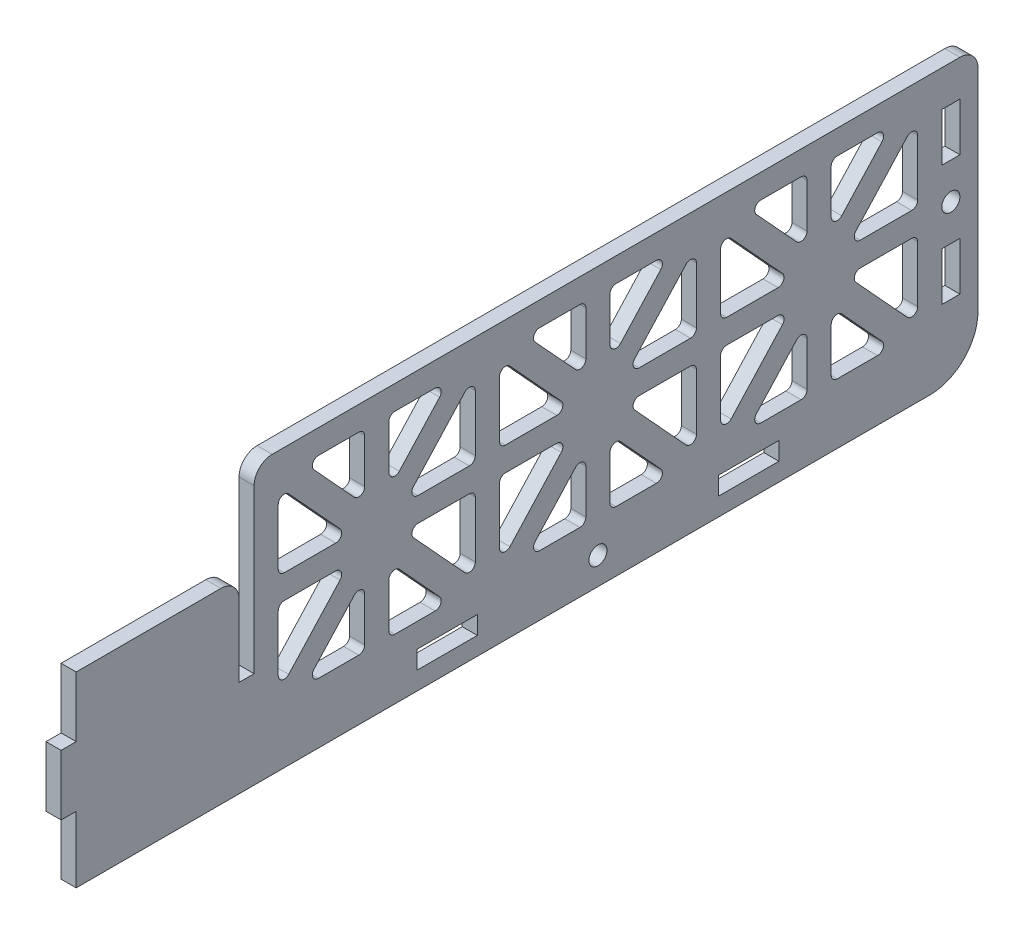
from build123d import *

# Parameters (mm, degrees)
SKETCH_1_R          = 1.5
SKETCH_1_W          = 3
SKETCH_1_H          = 8
SKETCH_1_W_2        = 10
SKETCH_1_H_2        = 3
EXTRUDE_1_DEPTH     = 2.5
FILLET_1_R          = 8
FILLET_2_R          = 3
CUT_EXTRUDE_1_DEPTH = 157.436888233
FILLET_3_R          = 1


with BuildPart() as part:
    # 草图1 → 凸台-拉伸1 (new body)
    with BuildSketch(Plane(origin=(0, 0, 0), x_dir=(0, 0, -1), z_dir=(1, 0, 0))):
        Polygon((0, 0), (149.5, 0), (149.5, 46), (29.5, 46), (29.5, 16), (27, 16), (27, 31), (0, 31), (0, 21), (-2.5, 21), (-2.5, 11), (0, 11), align=None)
        with Locations((86.5, 4.5)):
            Circle(SKETCH_1_R, mode=Mode.SUBTRACT)
        with Locations((145, 26)):
            Circle(SKETCH_1_R, mode=Mode.SUBTRACT)
        with Locations((145, 36)):
            Rectangle(SKETCH_1_W, SKETCH_1_H, mode=Mode.SUBTRACT)
        with Locations((145, 16)):
            Rectangle(SKETCH_1_W, SKETCH_1_H, mode=Mode.SUBTRACT)
        with Locations((111.5, 4.5)):
            Rectangle(SKETCH_1_W_2, SKETCH_1_H_2, mode=Mode.SUBTRACT)
        with Locations((61.5, 4.5)):
            Rectangle(SKETCH_1_W_2, SKETCH_1_H_2, mode=Mode.SUBTRACT)
    extrude(amount=EXTRUDE_1_DEPTH)

    # 圆角1
    fillet_1_edges = [part.edges().sort_by_distance(p)[0] for p in [
        (1.25, 0, -149.5),
    ]]
    fillet(fillet_1_edges, radius=FILLET_1_R)

    # 圆角2
    fillet_2_edges = [part.edges().sort_by_distance(p)[0] for p in [
        (1.25, 31, -27),
        (1.25, 46, -29.5),
        (1.25, 46, -149.5),
    ]]
    fillet(fillet_2_edges, radius=FILLET_2_R)

    # 草图2 → 切除-拉伸1 (cut, through all)
    with BuildSketch(Plane(origin=(2.5, 0, 0), x_dir=(0, 0, -1), z_dir=(1, 0, 0))):
        Polygon((21.09397139, 104.600915735), (21.09397139, 93.014462547), (31.100453689, 93.014462547), align=None)
        Polygon((25.191142636, 105.976587705), (33.21163679, 96.689699737), (33.21163679, 105.976587705), align=None)
        Polygon((37.21163679, 105.976587705), (45.232130944, 105.976587705), (37.21163679, 96.689699737), align=None)
        Polygon((49.32930219, 93.014462547), (39.322819891, 93.014462547), (49.32930219, 104.600915735), align=None)
        Polygon((49.32930219, 78.0271398), (49.32930219, 89.613592988), (39.322819891, 89.613592988), align=None)
        Polygon((37.21163679, 85.938355799), (37.21163679, 76.651467831), (45.232130944, 76.651467831), align=None)
        Polygon((33.21163679, 76.651467831), (25.191142636, 76.651467831), (33.21163679, 85.938355799), align=None)
        Polygon((21.09397139, 89.613592988), (31.100453689, 89.613592988), (21.09397139, 78.0271398), align=None)
        Polygon((33.5, 40.858396255), (33.5, 28), (45.286863234, 28), align=None)
        Polygon((37.879803433, 42), (47.833333333, 31.141603745), (47.833333333, 42), align=None)
        Polygon((51.833333333, 42), (61.786863234, 42), (51.833333333, 31.141603745), align=None)
        Polygon((66.166666667, 28), (54.379803433, 28), (66.166666667, 40.858396255), align=None)
        Polygon((66.166666667, 11.141603745), (66.166666667, 24), (54.379803433, 24), align=None)
        Polygon((51.833333333, 20.858396255), (51.833333333, 10), (61.786863234, 10), align=None)
        Polygon((47.833333333, 10), (37.879803433, 10), (47.833333333, 20.858396255), align=None)
        Polygon((33.5, 24), (45.286863234, 24), (33.5, 11.141603745), align=None)
        Polygon((70.166666667, 40.858396255), (70.166666667, 28), (81.953529901, 28), align=None)
        Polygon((74.546470099, 42), (84.5, 31.141603745), (84.5, 42), align=None)
        Polygon((88.5, 42), (98.453529901, 42), (88.5, 31.141603745), align=None)
        Polygon((102.833333333, 28), (91.046470099, 28), (102.833333333, 40.858396255), align=None)
        Polygon((102.833333333, 11.141603745), (102.833333333, 24), (91.046470099, 24), align=None)
        Polygon((88.5, 20.858396255), (88.5, 10), (98.453529901, 10), align=None)
        Polygon((84.5, 10), (74.546470099, 10), (84.5, 20.858396255), align=None)
        Polygon((70.166666667, 24), (81.953529901, 24), (70.166666667, 11.141603745), align=None)
        Polygon((106.833333333, 40.858396255), (106.833333333, 28), (118.620196567, 28), align=None)
        Polygon((111.213136766, 42), (121.166666667, 31.141603745), (121.166666667, 42), align=None)
        Polygon((125.166666667, 42), (135.120196567, 42), (125.166666667, 31.141603745), align=None)
        Polygon((139.5, 28), (127.713136766, 28), (139.5, 40.858396255), align=None)
        Polygon((139.5, 11.141603745), (139.5, 24), (127.713136766, 24), align=None)
        Polygon((125.166666667, 20.858396255), (125.166666667, 10), (135.120196567, 10), align=None)
        Polygon((121.166666667, 10), (111.213136766, 10), (121.166666667, 20.858396255), align=None)
        Polygon((106.833333333, 24), (118.620196567, 24), (106.833333333, 11.141603745), align=None)
    extrude(amount=-CUT_EXTRUDE_1_DEPTH, mode=Mode.SUBTRACT)

    # 圆角3
    fillet_3_edges = [part.edges().sort_by_distance(p)[0] for p in [
        (1.25, 11.141603745, -66.166666667),
        (1.25, 24, -54.379803433),
        (1.25, 24, -66.166666667),
        (1.25, 40.858396255, -66.166666667),
        (1.25, 28, -66.166666667),
        (1.25, 28, -54.379803433),
        (1.25, 31.141603745, -51.833333333),
        (1.25, 42, -51.833333333),
        (1.25, 42, -61.786863234),
        (1.25, 42, -47.833333333),
        (1.25, 31.141603745, -47.833333333),
        (1.25, 42, -37.879803433),
        (1.25, 40.858396255, -70.166666667),
        (1.25, 28, -81.953529901),
        (1.25, 28, -70.166666667),
        (1.25, 11.141603745, -33.5),
        (1.25, 24, -33.5),
        (1.25, 24, -45.286863234),
        (1.25, 20.858396255, -47.833333333),
        (1.25, 10, -47.833333333),
        (1.25, 10, -37.879803433),
        (1.25, 20.858396255, -51.833333333),
        (1.25, 10, -61.786863234),
        (1.25, 10, -51.833333333),
        (1.25, 40.858396255, -33.5),
        (1.25, 28, -45.286863234),
        (1.25, 28, -33.5),
        (1.25, 11.141603745, -139.5),
        (1.25, 24, -127.713136766),
        (1.25, 24, -139.5),
        (1.25, 40.858396255, -139.5),
        (1.25, 28, -139.5),
        (1.25, 28, -127.713136766),
        (1.25, 31.141603745, -125.166666667),
        (1.25, 42, -125.166666667),
        (1.25, 42, -135.120196567),
        (1.25, 42, -121.166666667),
        (1.25, 31.141603745, -121.166666667),
        (1.25, 42, -111.213136766),
        (1.25, 11.141603745, -106.833333333),
        (1.25, 24, -106.833333333),
        (1.25, 24, -118.620196567),
        (1.25, 20.858396255, -121.166666667),
        (1.25, 10, -121.166666667),
        (1.25, 10, -111.213136766),
        (1.25, 20.858396255, -125.166666667),
        (1.25, 10, -135.120196567),
        (1.25, 10, -125.166666667),
        (1.25, 11.141603745, -102.833333333),
        (1.25, 24, -91.046470099),
        (1.25, 24, -102.833333333),
        (1.25, 40.858396255, -102.833333333),
        (1.25, 28, -102.833333333),
        (1.25, 28, -91.046470099),
        (1.25, 31.141603745, -88.5),
        (1.25, 42, -88.5),
        (1.25, 42, -98.453529901),
        (1.25, 42, -84.5),
        (1.25, 31.141603745, -84.5),
        (1.25, 42, -74.546470099),
        (1.25, 40.858396255, -106.833333333),
        (1.25, 28, -118.620196567),
        (1.25, 28, -106.833333333),
        (1.25, 11.141603745, -70.166666667),
        (1.25, 24, -70.166666667),
        (1.25, 24, -81.953529901),
        (1.25, 20.858396255, -84.5),
        (1.25, 10, -84.5),
        (1.25, 10, -74.546470099),
        (1.25, 20.858396255, -88.5),
        (1.25, 10, -98.453529901),
        (1.25, 10, -88.5),
    ]]
    fillet(fillet_3_edges, radius=FILLET_3_R)


solid = part.part
